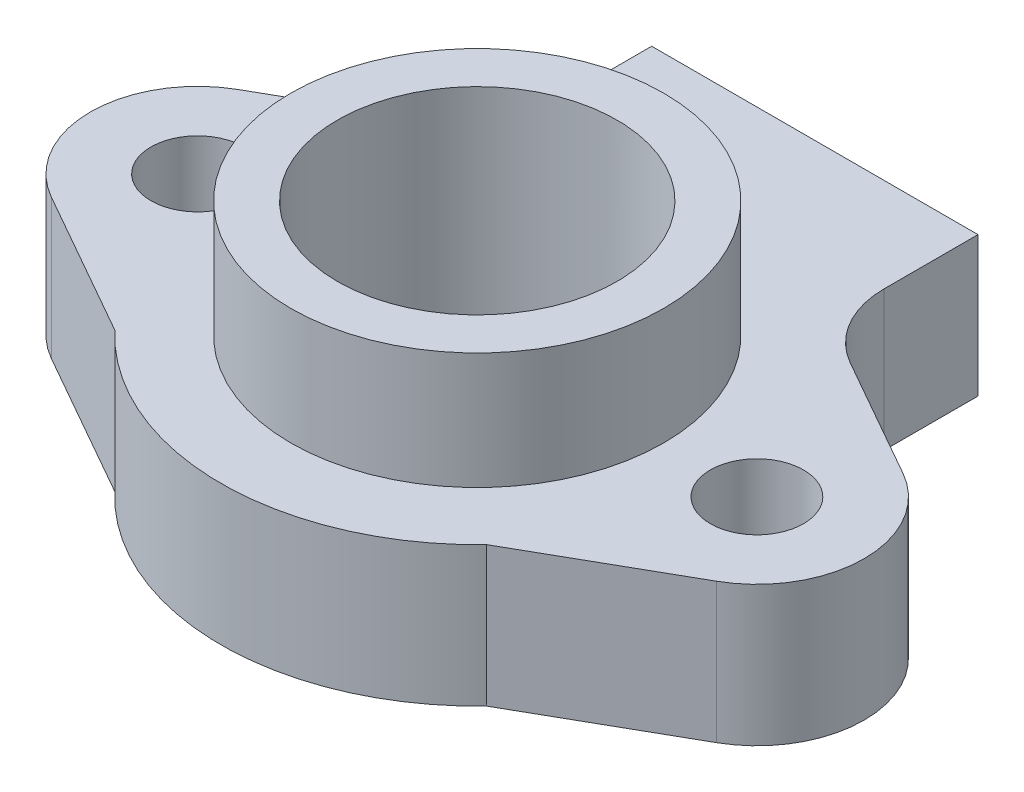
from build123d import *

# Parameters (mm, degrees)
BOSS_EXTRUDE1_DEPTH        = 55
BOSS_EXTRUDE1_DEPTH_BACK   = 5
SKETCH1_R                  = 40
SKETCH1_R_2                = 30
SKETCH2_R                  = 10
SKETCH2_R_2                = 30
BOSS_EXTRUDE2_DEPTH        = 30
FILLET1_R                  = 20
SKETCH3_W                  = 60
SKETCH3_H                  = 20
CUT_EXTRUDE1_DEPTH         = 25
M10X1_0_TAPPED_HOLE1_D     = 9
M10X1_0_TAPPED_HOLE1_DEPTH = 43
M10X1_0_TAPPED_HOLE1_TIP   = 2.703872786


with BuildPart() as part:
    # Sketch1 → Boss-Extrude1 (new, two sides: drawn at the far end of the back side and taken through both)
    with BuildSketch(Plane(origin=(0, 0, 0), x_dir=(1, 0, 0), z_dir=(0, 1, 0)).offset(-BOSS_EXTRUDE1_DEPTH_BACK)):
        with Locations(Location((0, 0, 0), (0, 0, 270))):
            Circle(SKETCH1_R)
        with Locations(Location((0, 0, 0), (0, 0, 270))):
            Circle(SKETCH1_R_2, mode=Mode.SUBTRACT)
    extrude(amount=BOSS_EXTRUDE1_DEPTH + BOSS_EXTRUDE1_DEPTH_BACK)

    # Sketch2 → Boss-Extrude2 (add)
    with BuildSketch(Plane(origin=(0, 0, 0), x_dir=(1, 0, 0), z_dir=(0, 1, 0))):
        with BuildLine():
            Line((39.875, -37.881187613), (71.35896205, -19.999349518))
            ThreePointArc((71.35896205, -19.999349518), (83, 0), (71.35896205, 19.999349518))
            Line((71.35896205, 19.999349518), (39.875, 37.881187613))
            Line((39.875, 37.881187613), (35, 40.650024667))
            Line((35, 40.650024667), (35, 72.426406871))
            Line((35, 72.426406871), (-35, 72.426406871))
            Line((-35, 72.426406871), (-35, 40.650024667))
            Line((-35, 40.650024667), (-39.875, 37.881187613))
            Line((-39.875, 37.881187613), (-71.35896205, 19.999349518))
            ThreePointArc((-71.35896205, 19.999349518), (-83, 0), (-71.35896205, -19.999349518))
            Line((-71.35896205, -19.999349518), (-39.875, -37.881187613))
            ThreePointArc((-39.875, -37.881187613), (0, -55), (39.875, -37.881187613))
        make_face()
        with Locations(Location((-60, 0, 0), (0, 0, 270))):
            Circle(SKETCH2_R, mode=Mode.SUBTRACT)
        with Locations(Location((0, 0, 0), (0, 0, 270))):
            Circle(SKETCH2_R_2, mode=Mode.SUBTRACT)
        with Locations(Location((60, 0, 0), (0, 0, 270))):
            Circle(SKETCH2_R, mode=Mode.SUBTRACT)
    extrude(amount=BOSS_EXTRUDE2_DEPTH)

    # Fillet1
    fillet1_edges = [part.edges().sort_by_distance(p)[0] for p in [
        (35, 15, -40.650024667),
        (-35, 15, -40.650024667),
    ]]
    fillet(fillet1_edges, radius=FILLET1_R)

    # Sketch3 → Cut-Extrude1 (cut)
    with BuildSketch(Plane(origin=(0, 0, -72.426406871), x_dir=(-1, 0, 0), z_dir=(0, 0, -1))):
        with Locations((0, 15)):
            Rectangle(SKETCH3_W, SKETCH3_H)
    extrude(amount=-CUT_EXTRUDE1_DEPTH, mode=Mode.SUBTRACT)

    # M10x1.0 Tapped Hole1
    with Locations(Plane(origin=(0, 15, -47.426406871), x_dir=(-1, 0, 0), z_dir=(0, 0, -1))):
        with Locations((0, 0)):
            Hole(M10X1_0_TAPPED_HOLE1_D / 2, depth=M10X1_0_TAPPED_HOLE1_DEPTH)
            with Locations((0, 0, -(M10X1_0_TAPPED_HOLE1_DEPTH + M10X1_0_TAPPED_HOLE1_TIP / 2))):  # 118° drill point
                Cone(0, M10X1_0_TAPPED_HOLE1_D / 2, M10X1_0_TAPPED_HOLE1_TIP, mode=Mode.SUBTRACT)


solid = part.part
